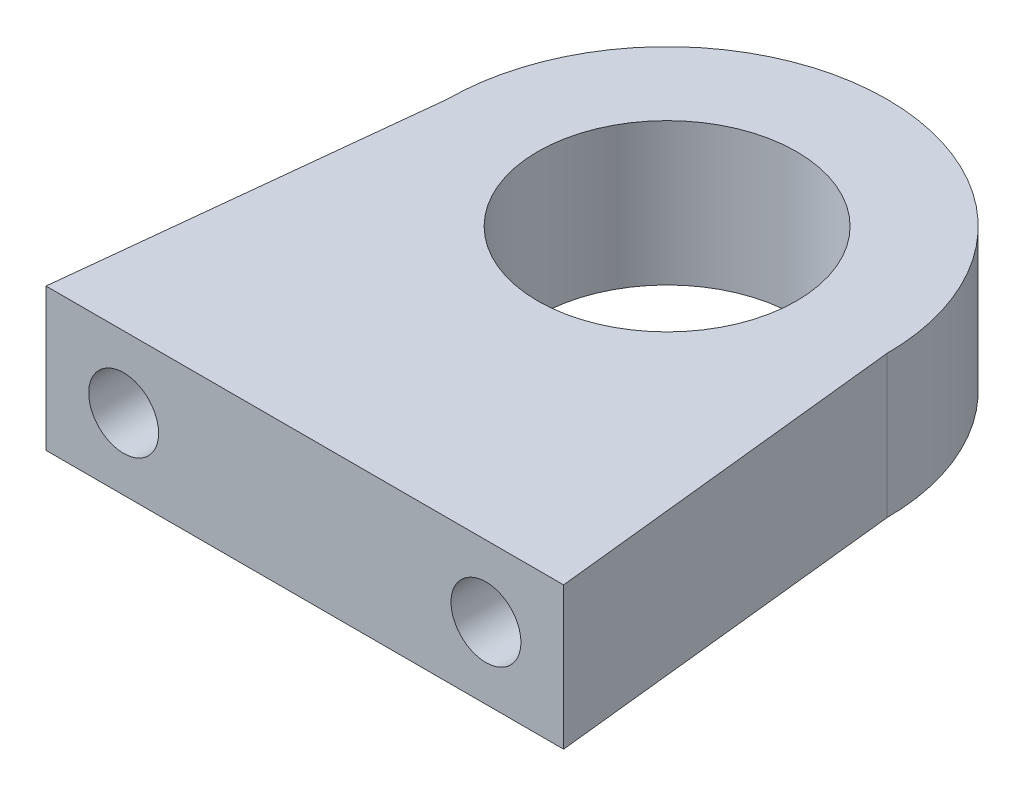
from build123d import *

# Parameters (mm, degrees)
SKETCH1_R           = 5
BOSS_EXTRUDE1_DEPTH = 5.5
SKETCH2_R           = 1.35
CUT_EXTRUDE1_DEPTH  = 10


with BuildPart() as part:
    # Sketch1 → Boss-Extrude1 (new body)
    with BuildSketch(Plane(origin=(0, 0, 0), x_dir=(1, 0, 0), z_dir=(0, 1, 0))):
        with BuildLine():
            Line((-10, 0), (-8.5, 14))
            ThreePointArc((-8.5, 14), (0, 22.5), (8.5, 14))
            Line((8.5, 14), (10, 0))
            Line((10, 0), (-10, 0))
        make_face()
        with Locations(Location((0, 14, 0), (0, 0, 270))):
            Circle(SKETCH1_R, mode=Mode.SUBTRACT)
    extrude(amount=BOSS_EXTRUDE1_DEPTH)

    # Sketch2 → Cut-Extrude1 (cut)
    with BuildSketch(Plane.XY):
        with Locations((-7, 2.75)):
            Circle(SKETCH2_R)
        with Locations(Location((7, 2.75, 0), (0, 0, 180))):
            Circle(SKETCH2_R)
    extrude(amount=-CUT_EXTRUDE1_DEPTH, mode=Mode.SUBTRACT)


solid = part.part
